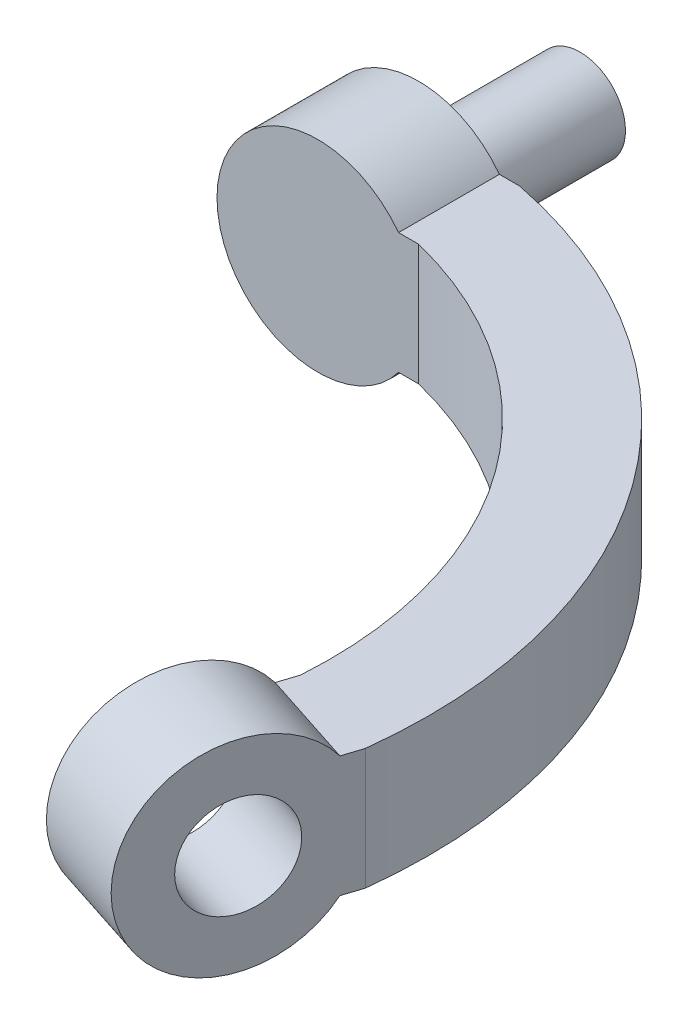
from build123d import *

# Parameters (mm, degrees)
SKETCH_2_R           = 5
EXTRUDE_3_DEPTH      = 5
EXTRUDE_4_DEPTH      = 3
EXTRUDE_4_DEPTH_BACK = 3
SKETCH_4_W           = 5
SKETCH_4_H           = 6
EXTRUDE_5_DEPTH      = 3
SKETCH_5_W           = 5
SKETCH_5_H           = 6
EXTRUDE_6_DEPTH      = 3
SKETCH_6_R           = 2.5
CUT_EXTRUDE_1_DEPTH  = 5
EXTRUDE_START        = -5
SKETCH_7_R           = 2.25
EXTRUDE_7_DEPTH      = 8


with BuildPart() as part:
    # 草图2 → 凸台-拉伸3 (new body)
    with BuildSketch(Plane.XY):
        Circle(SKETCH_2_R)
    extrude(amount=EXTRUDE_3_DEPTH)



with BuildPart() as body_2:
    # 草图3 → 凸台-拉伸4 (new, two sides: drawn at the far end of the back side and taken through both)
    with BuildSketch(Plane(origin=(0, 0, 0), x_dir=(1, 0, 0), z_dir=(0, 1, 0)).offset(-EXTRUDE_4_DEPTH_BACK)):
        with BuildLine():
            ThreePointArc((5, 0), (20.625967206, -10.014357644), (25.321497879, -27.970142278))
            Line((25.321497879, -27.970142278), (20.566215298, -26.425057306))
            ThreePointArc((20.566215298, -26.425057306), (16.678312604, -12.882496598), (5, -5))
            Line((5, -5), (5, 0))
        make_face()
    extrude(amount=EXTRUDE_4_DEPTH + EXTRUDE_4_DEPTH_BACK)



with BuildPart() as body_3:
    # 草图3<3> → 旋转1 (revolve)
    with BuildSketch(Plane(origin=(0, 0, 0), x_dir=(1, 0, 0), z_dir=(0, 1, 0)), mode=Mode.PRIVATE) as revolve_1_sk:
        Polygon((25.321497879, -27.970142278), (20.566215298, -26.425057306), (19.021130326, -31.180339887), (23.776412907, -32.725424859), align=None)
    revolve(revolve_1_sk.sketch.rotate(Axis((0, 0, 25), (0.9510565162951546, 0, 0.3090169943749442)), 180), axis=Axis((0, 0, 25), (0.9510565162951546, 0, 0.3090169943749442)))


with BuildPart() as body_2_1:
    add(body_2.part)

    add(body_3.part)  # 凸台-拉伸5 merges body 3
    # 草图4 → 凸台-拉伸5 (add)
    with BuildSketch(Plane(origin=(-5.802230682, 0, 17.857429848), x_dir=(0.9510565162951545, 0, 0.309016994374945), z_dir=(-0.309016994374945, 0, 0.9510565162951545))):
        with Locations((30.225424859, 0)):
            Rectangle(SKETCH_4_W, SKETCH_4_H)
    extrude(amount=EXTRUDE_5_DEPTH)


with BuildPart() as part_1:
    add(part.part)

    add(body_2_1.part)  # 凸台-拉伸6 merges body 2
    # 草图5 → 凸台-拉伸6 (add)
    with BuildSketch(Plane.ZY.offset(-5)):
        with Locations((2.5, 0)):
            Rectangle(SKETCH_5_W, SKETCH_5_H)
    extrude(amount=EXTRUDE_6_DEPTH)

    # 草图6 → 切除-拉伸1 (cut)
    with BuildSketch(Plane(origin=(26.36844598, 0, 8.567627458), x_dir=(-0.309016994374945, 0, 0.9510565162951545), z_dir=(-0.9510565162951545, 0, -0.309016994374945))):
        with Locations((23.776412907, 0)):
            Circle(SKETCH_6_R)
    extrude(amount=-CUT_EXTRUDE_1_DEPTH, mode=Mode.SUBTRACT)

    # 草图7 → 凸台-拉伸7 (add)
    with BuildSketch(Plane.XY.offset(5).offset(EXTRUDE_START)):
        Circle(SKETCH_7_R)
    extrude(amount=-EXTRUDE_7_DEPTH)


solid = part_1.part
